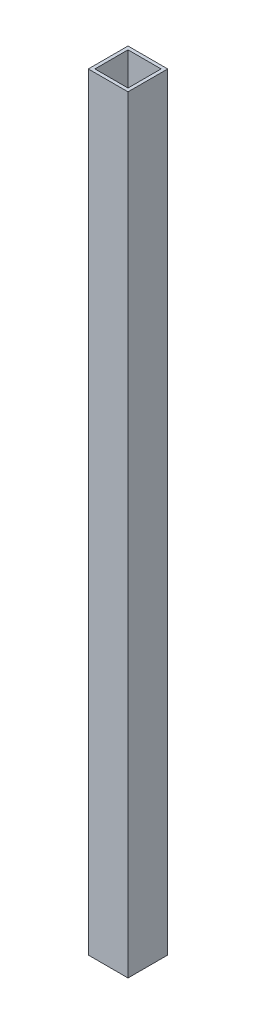
from build123d import *

# Parameters (mm, degrees)
SKETCH1_W           = 19.05
SKETCH1_H           = 19.05
SKETCH1_W_2         = 15.875
SKETCH1_H_2         = 15.875
BOSS_EXTRUDE1_DEPTH = 368.3


with BuildPart() as part:
    # Sketch1 → Boss-Extrude1 (new body)
    with BuildSketch(Plane(origin=(0, 0, 0), x_dir=(1, 0, 0), z_dir=(0, 1, 0))):
        with Locations((9.525, 9.525)):
            Rectangle(SKETCH1_W, SKETCH1_H)
        with Locations((9.525, 9.525)):
            Rectangle(SKETCH1_W_2, SKETCH1_H_2, mode=Mode.SUBTRACT)
    extrude(amount=BOSS_EXTRUDE1_DEPTH)


solid = part.part
